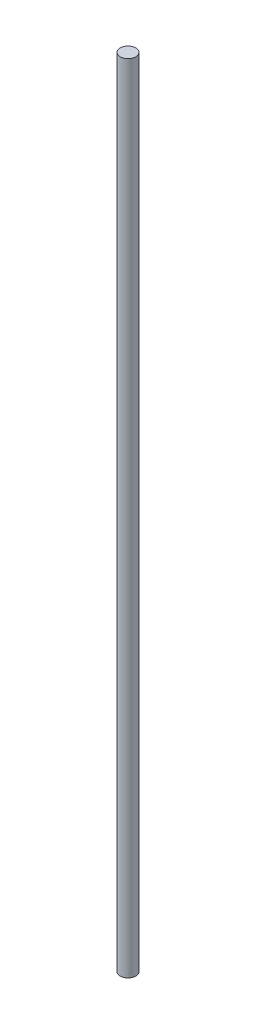
from build123d import *

# Parameters (mm, degrees)
SKETCH1_R           = 2.413
BOSS_EXTRUDE1_DEPTH = 247.65


with BuildPart() as part:
    # Sketch1 → Boss-Extrude1 (new body)
    with BuildSketch(Plane(origin=(0, 0, 0), x_dir=(1, 0, 0), z_dir=(0, 1, 0))):
        with Locations(Location((0, 0, 0), (0, 0, 270))):
            Circle(SKETCH1_R)
    extrude(amount=BOSS_EXTRUDE1_DEPTH)


solid = part.part
